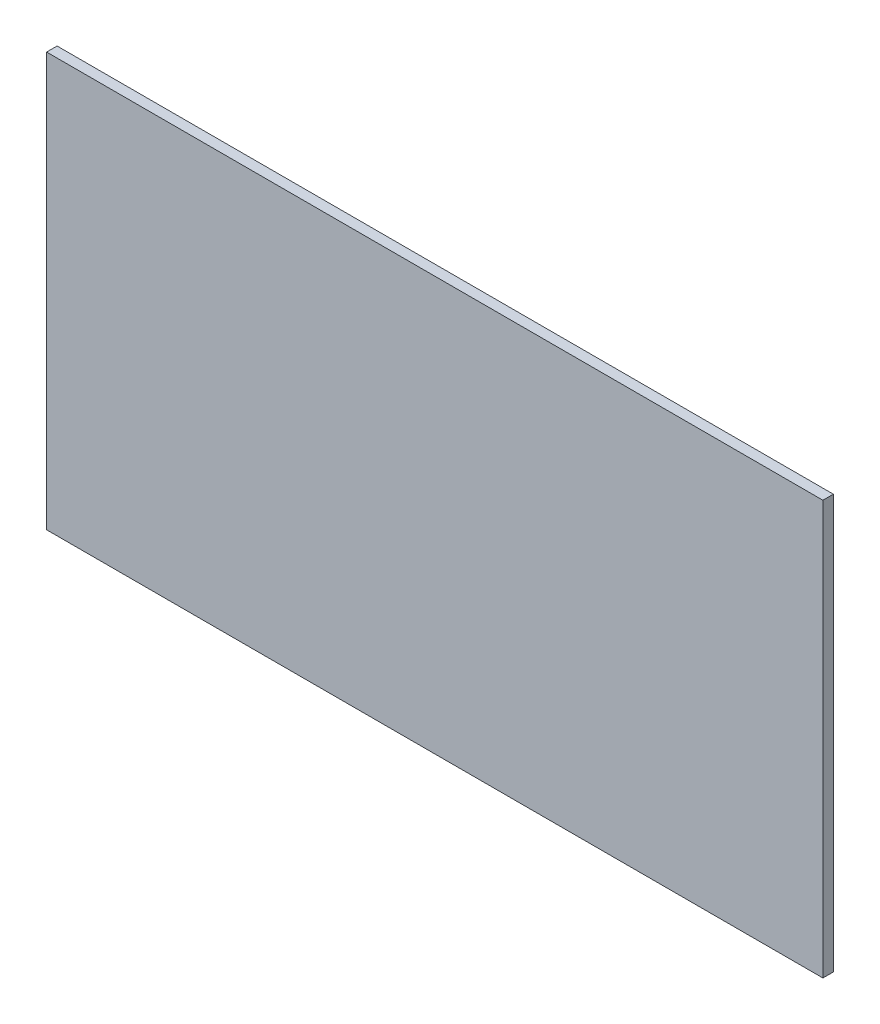
from build123d import *

# Parameters (mm, degrees)
SKETCH1_W           = 74.104
SKETCH1_H           = 39.5
BOSS_EXTRUDE1_DEPTH = 1


with BuildPart() as part:
    # Sketch1 → Boss-Extrude1 (new body)
    with BuildSketch(Plane.XY):
        with Locations((37.052, 19.75)):
            Rectangle(SKETCH1_W, SKETCH1_H)
    extrude(amount=BOSS_EXTRUDE1_DEPTH)


solid = part.part
